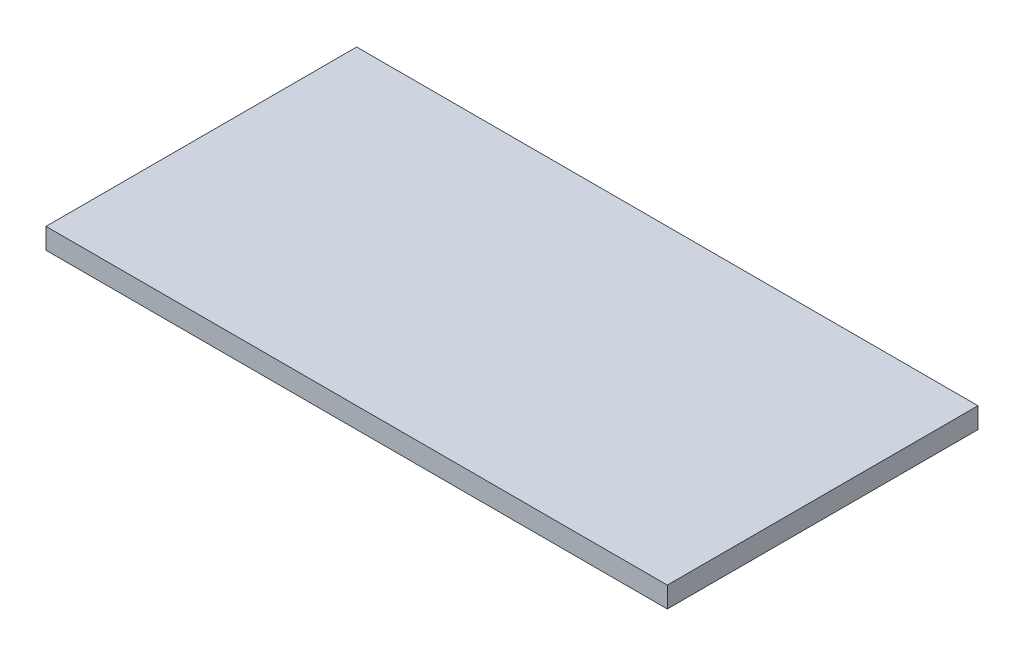
from build123d import *

# Parameters (mm, degrees)
SKETCH1_W           = 60
SKETCH1_H           = 30
BOSS_EXTRUDE1_DEPTH = 2


with BuildPart() as part:
    # Sketch1 → Boss-Extrude1 (new body)
    with BuildSketch(Plane(origin=(0, 0, 0), x_dir=(1, 0, 0), z_dir=(0, 1, 0))):
        with Locations((30, -15)):
            Rectangle(SKETCH1_W, SKETCH1_H)
    extrude(amount=BOSS_EXTRUDE1_DEPTH)


solid = part.part
